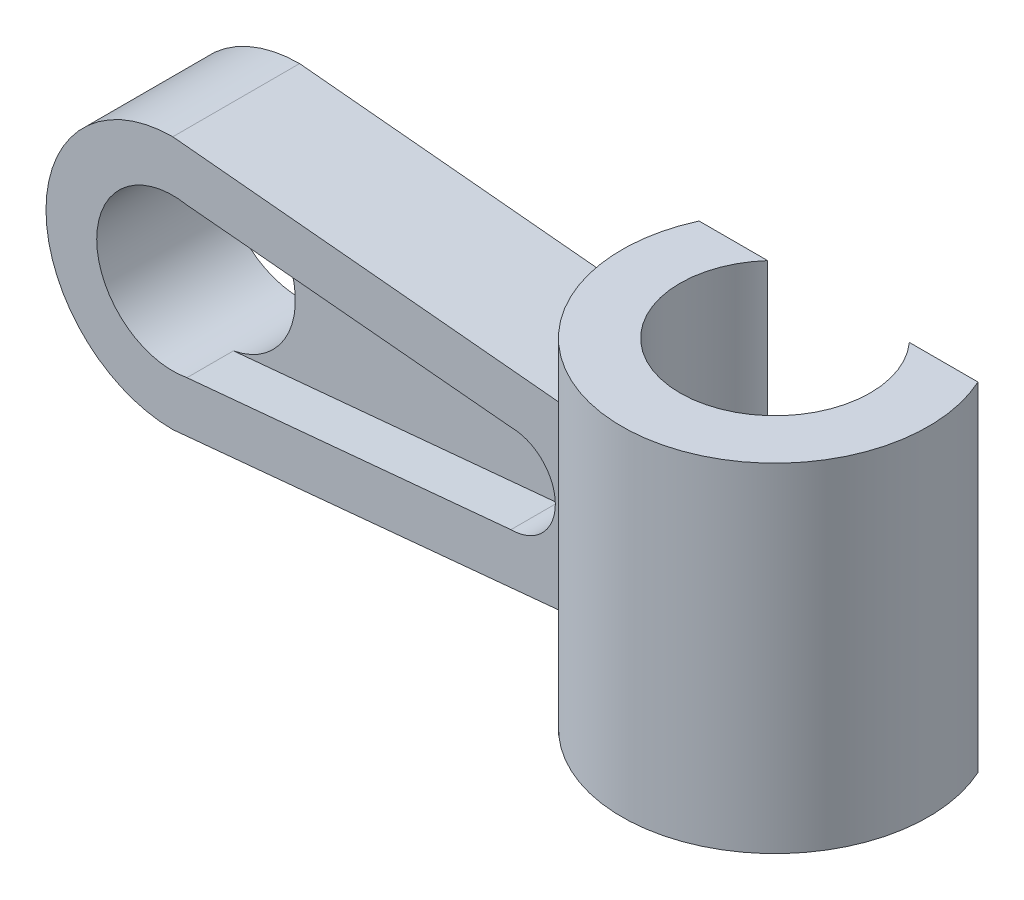
from build123d import *

# Parameters (mm, degrees)
BOSS_EXTRU_1_DEPTH      = 6
ENL_V_MAT_EXTRU_1_REACH = 24.65
ESQUISSE2_R             = 3.6
ENL_V_START             = -2.2
ENL_V_MAT_EXTRU_2_DEPTH = 2.2
ESQUISSE6_W             = 2.75
ESQUISSE6_H             = 16
ENL_V_MAT_EXTRU_4_REACH = 37.477
ESQUISSE7_W             = 29.554917854
ESQUISSE7_H             = 36.646442603


with BuildPart() as part:
    # Esquisse1 → Boss.-Extru.1 (new body)
    with BuildSketch(Plane.XY):
        with BuildLine():
            Line((0, 6), (21, 4))
            Line((21, 4), (21, -4))
            Line((21, -4), (0, -6))
            ThreePointArc((0, -6), (-6, 0), (0, 6))
        make_face()
    extrude(amount=BOSS_EXTRU_1_DEPTH)

    # Esquisse2 → Enlèv. mat.-Extru.1 (cut, up to next)
    with BuildSketch(Plane(origin=(0, 0, 0), x_dir=(-1, 0, 0), z_dir=(0, 0, -1)), mode=Mode.PRIVATE) as enl_v_mat_extru_1_sk1:
        Circle(ESQUISSE2_R)
    enl_v_mat_extru_1_tool1 = extrude(enl_v_mat_extru_1_sk1.sketch, amount=-ENL_V_MAT_EXTRU_1_REACH, mode=Mode.PRIVATE) & part.part
    add(enl_v_mat_extru_1_tool1.solids().sort_by_distance((0, 0, 0))[0], mode=Mode.SUBTRACT)

    # Esquisse3 → Enlèv. mat.-Extru.2 (cut)
    with BuildSketch(Plane.XY.offset(6).offset(ENL_V_START)):
        with BuildLine():
            Line((0, 3.6), (16, 2.1))
            ThreePointArc((16, 2.1), (18.1, 0), (16, -2.1))
            Line((16, -2.1), (0, -3.6))
            ThreePointArc((0, -3.6), (-3.6, 0), (0, 3.6))
        make_face()
    extrude(amount=ENL_V_MAT_EXTRU_2_DEPTH, mode=Mode.SUBTRACT)

    # Esquisse6 → Révolution1 (revolve)
    with BuildSketch(Plane.XY.offset(3)):
        with Locations((19.625, 1)):
            Rectangle(ESQUISSE6_W, ESQUISSE6_H)
    revolve(axis=Axis((25.5, 9, 3), (0, -1, 0)))

    # Esquisse7 → Enlèv. mat.-Extru.4 (cut, up to next)
    with BuildSketch(Plane(origin=(0, 0, 0), x_dir=(-1, 0, 0), z_dir=(0, 0, -1)), mode=Mode.PRIVATE) as enl_v_mat_extru_4_sk1:
        with Locations((-30.387795564, 1.156001867)):
            Rectangle(ESQUISSE7_W, ESQUISSE7_H)
    enl_v_mat_extru_4_tool1 = extrude(enl_v_mat_extru_4_sk1.sketch, amount=ENL_V_MAT_EXTRU_4_REACH, mode=Mode.PRIVATE) & part.part
    add(enl_v_mat_extru_4_tool1.solids().sort_by_distance((30.387796, 1.156002, 0))[0], mode=Mode.SUBTRACT)


solid = part.part
